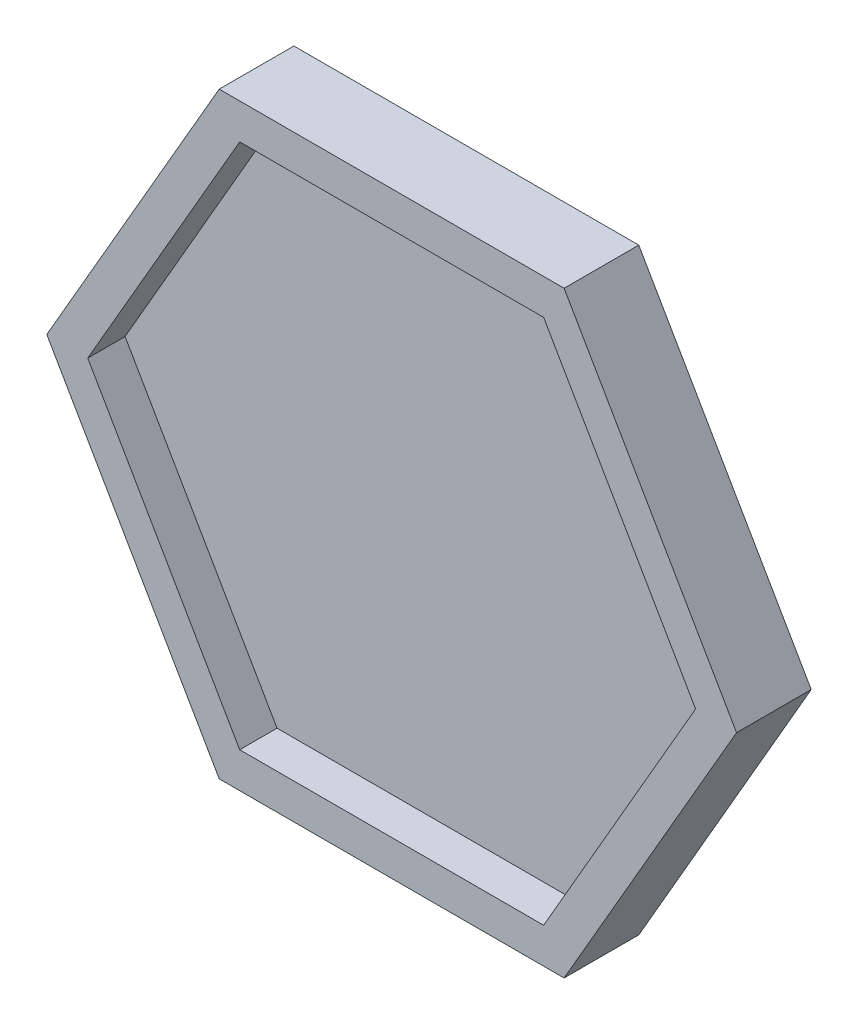
from build123d import *

# Parameters (mm, degrees)
BOSS_EXTRUDE1_DEPTH      = 1
BOSS_EXTRUDE1_DEPTH_BACK = 2.5
BOSS_EXTRUDE2_DEPTH      = 2.5
BOSS_EXTRUDE3_DEPTH      = 1
BOSS_EXTRUDE4_DEPTH      = 1
CUT_EXTRUDE1_DEPTH       = 13.71154331


with BuildPart() as part:
    # Sketch1 → Boss-Extrude1 (new, two sides: drawn at the far end of the back side and taken through both)
    with BuildSketch(Plane.XY.offset(-BOSS_EXTRUDE1_DEPTH_BACK)):
        Polygon((8.082903769, 0), (4.041451884, 7), (-4.041451884, 7), (-8.082903769, 0), (-4.041451884, -7), (4.041451884, -7), align=None)
        Polygon((5.888972746, 0), (2.944486373, 5.1), (-2.944486373, 5.1), (-5.888972746, 0), (-2.944486373, -5.1), (2.944486373, -5.1), align=None, mode=Mode.SUBTRACT)
    extrude(amount=BOSS_EXTRUDE1_DEPTH + BOSS_EXTRUDE1_DEPTH_BACK)

    # Sketch3 → Boss-Extrude2 (add)
    with BuildSketch(Plane.XY):
        Polygon((5.888972746, 0), (2.944486373, 5.1), (-2.944486373, 5.1), (-5.888972746, 0), (-2.944486373, -5.1), (2.944486373, -5.1), align=None)
        Polygon((5.542562584, 0), (2.771281292, 4.8), (-2.771281292, 4.8), (-5.542562584, 0), (-2.771281292, -4.8), (2.771281292, -4.8), align=None, mode=Mode.SUBTRACT)
    extrude(amount=-BOSS_EXTRUDE2_DEPTH)

    # Sketch4 → Boss-Extrude3 (add)
    with BuildSketch(Plane(origin=(0, 0, -2.5), x_dir=(-1, 0, 0), z_dir=(0, 0, -1))):
        Polygon((9.237604307, 0), (4.618802154, 8), (-4.618802154, 8), (-9.237604307, 0), (-4.618802154, -8), (4.618802154, -8), align=None)
    extrude(amount=BOSS_EXTRUDE3_DEPTH)

    # Sketch5 → Boss-Extrude4 (add)
    with BuildSketch(Plane.XY.offset(-2.5)):
        Polygon((-4.618802154, 8), (-9.237604307, 0), (-4.618802154, -8), (4.618802154, -8), (9.237604307, 0), (4.618802154, 8), align=None)
        Polygon((-4.070319398, 7.05), (-8.140638796, 0), (-4.070319398, -7.05), (4.070319398, -7.05), (8.140638796, 0), (4.070319398, 7.05), align=None, mode=Mode.SUBTRACT)
    extrude(amount=BOSS_EXTRUDE4_DEPTH)

    # Sketch5<2> → Cut-Extrude1 (cut, through all)
    with BuildSketch(Plane.XY.offset(-2.5)):
        Polygon((4.041451884, -7), (8.082903769, 0), (4.041451884, 7), (-4.041451884, 7), (-8.082903769, 0), (-4.041451884, -7), align=None)
        Polygon((5.542562584, 0), (2.771281292, -4.8), (-2.771281292, -4.8), (-5.542562584, 0), (-2.771281292, 4.8), (2.771281292, 4.8), align=None, mode=Mode.SUBTRACT)
    extrude(amount=CUT_EXTRUDE1_DEPTH, mode=Mode.SUBTRACT)


solid = part.part
